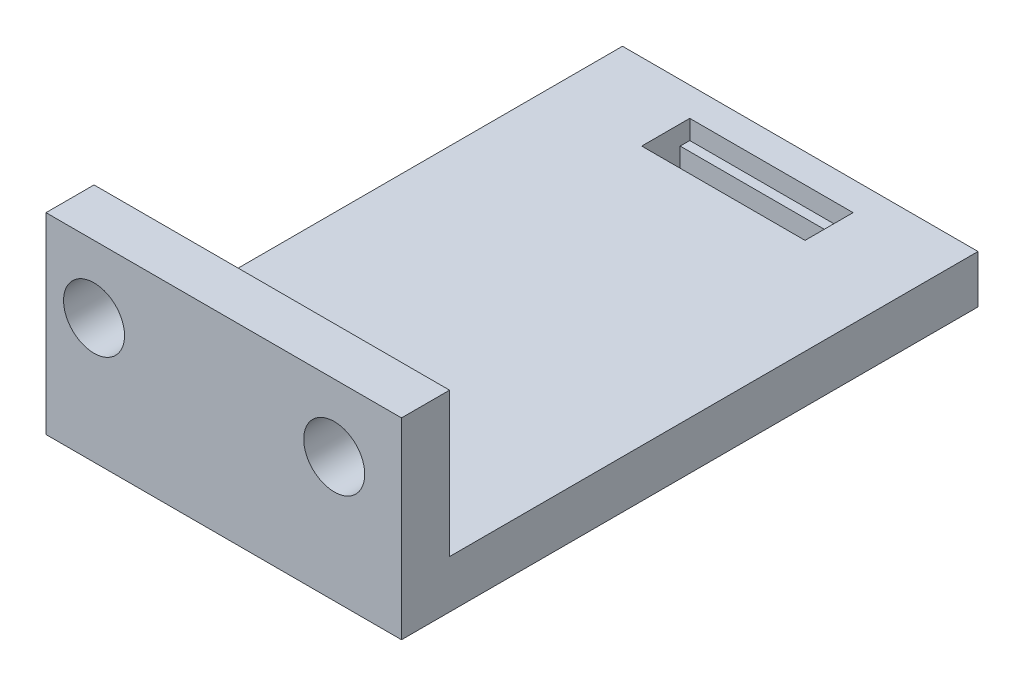
from build123d import *

# Parameters (mm, degrees)
SKETCH1_W           = 37
SKETCH1_H           = 55
SKETCH1_W_2         = 17
SKETCH1_H_2         = 3
BOSS_EXTRUDE1_DEPTH = 3
SKETCH2_W           = 37
SKETCH2_H           = 20
SKETCH2_R           = 3.175
BOSS_EXTRUDE2_DEPTH = 5
SKETCH3_W           = 37
SKETCH3_H           = 55
SKETCH3_W_2         = 17
SKETCH3_H_2         = 5
BOSS_EXTRUDE3_DEPTH = 2


with BuildPart() as part:
    # Sketch1 → Boss-Extrude1 (new body)
    with BuildSketch(Plane(origin=(0, 0, 0), x_dir=(1, 0, 0), z_dir=(0, 1, 0))):
        with Locations((18.5, -27.5)):
            Rectangle(SKETCH1_W, SKETCH1_H)
        with Locations((18.5, -5.5)):
            Rectangle(SKETCH1_W_2, SKETCH1_H_2, mode=Mode.SUBTRACT)
    extrude(amount=BOSS_EXTRUDE1_DEPTH)

    # Sketch2 → Boss-Extrude2 (add)
    with BuildSketch(Plane.XY.offset(55)):
        with Locations((18.5, 10)):
            Rectangle(SKETCH2_W, SKETCH2_H)
        with Locations((5, 13)):
            Circle(SKETCH2_R, mode=Mode.SUBTRACT)
        with Locations((30, 13)):
            Circle(SKETCH2_R, mode=Mode.SUBTRACT)
    extrude(amount=BOSS_EXTRUDE2_DEPTH)

    # Sketch3 → Boss-Extrude3 (add)
    with BuildSketch(Plane(origin=(0, 3, 0), x_dir=(1, 0, 0), z_dir=(0, 1, 0))):
        with Locations((18.5, -27.5)):
            Rectangle(SKETCH3_W, SKETCH3_H)
        with Locations((18.5, -5.5)):
            Rectangle(SKETCH3_W_2, SKETCH3_H_2, mode=Mode.SUBTRACT)
    extrude(amount=BOSS_EXTRUDE3_DEPTH)


solid = part.part
